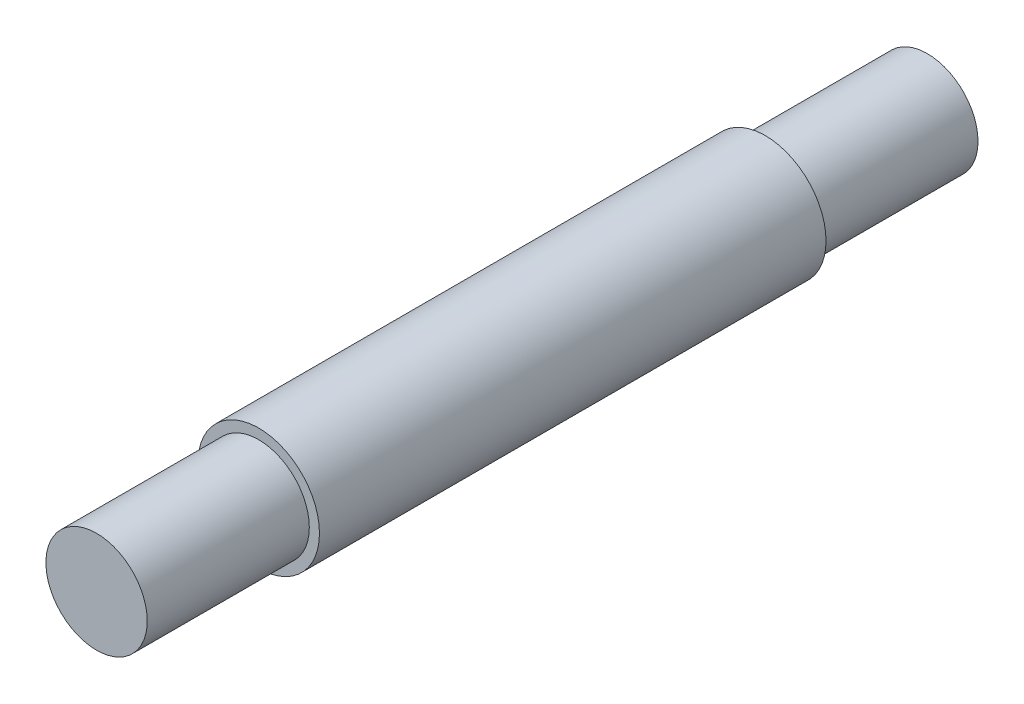
from build123d import *

# Parameters (mm, degrees)
SKETCH1_R           = 5
BOSS_EXTRUDE1_DEPTH = 82
SKETCH2_R           = 6
BOSS_EXTRUDE2_DEPTH = 50


with BuildPart() as part:
    # Sketch1 → Boss-Extrude1 (new body)
    with BuildSketch(Plane.XY):
        Circle(SKETCH1_R)
    extrude(amount=BOSS_EXTRUDE1_DEPTH)

    # Sketch2 → Boss-Extrude2 (add)
    with BuildSketch(Plane.XY.offset(66)):
        Circle(SKETCH2_R)
    extrude(amount=-BOSS_EXTRUDE2_DEPTH)


solid = part.part
